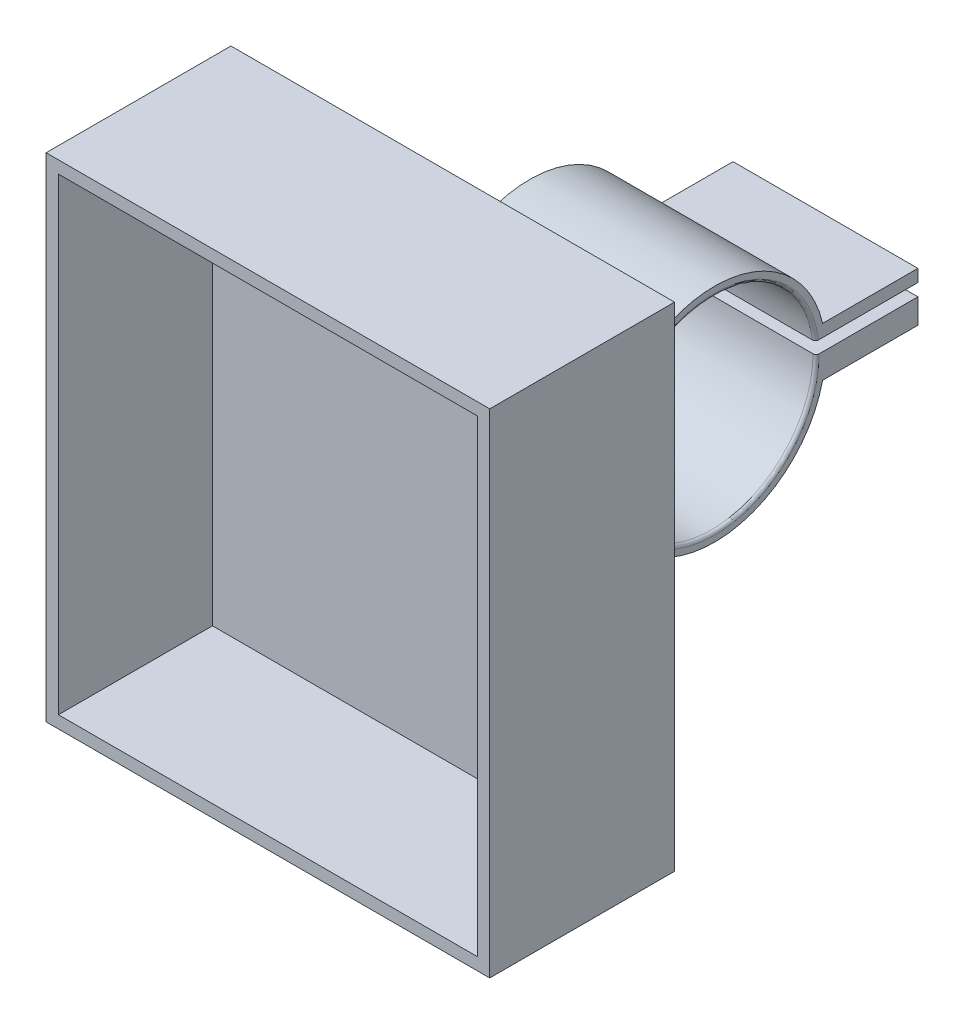
from build123d import *

# Parameters (mm, degrees)
ESBO_O1_W                     = 72
ESBO_O1_H                     = 80
RESSALTO_EXTRUS_O1_DEPTH      = 30
ESBO_O3_W                     = 68
ESBO_O3_H                     = 76
CORTE_EXTRUS_O1_DEPTH         = 25
ESBO_O7_R                     = 10.25
RESSALTO_EXTRUS_O3_DEPTH      = 15
FILETE1_R                     = 4
RESSALTO_EXTRUS_O4_DEPTH      = 15
RESSALTO_EXTRUS_O4_DEPTH_BACK = 15
ESBO_O9_R                     = 18
ESBO_O10_R                    = 16.5
CORTE_EXTRUS_O2_DEPTH         = 40
RESSALTO_EXTRUS_O5_DEPTH      = 15
RESSALTO_EXTRUS_O5_DEPTH_BACK = 15
ESBO_O12_W                    = 17
ESBO_O12_H                    = 2
CORTE_EXTRUS_O3_DEPTH         = 40
FILETE2_R                     = 0.5
FILETE3_R                     = 0.5


with BuildPart() as part:
    # Esboço1 → Ressalto-extrusão1 (new body)
    with BuildSketch(Plane.XY):
        Rectangle(ESBO_O1_W, ESBO_O1_H)
    extrude(amount=RESSALTO_EXTRUS_O1_DEPTH)

    # Esboço3 → Corte-extrusão1 (cut)
    with BuildSketch(Plane.XY.offset(30)):
        Rectangle(ESBO_O3_W, ESBO_O3_H)
    extrude(amount=-CORTE_EXTRUS_O1_DEPTH, mode=Mode.SUBTRACT)

    # Esboço7 → Ressalto-extrusão3 (add)
    with BuildSketch(Plane(origin=(0, 0, 0), x_dir=(-1, 0, 0), z_dir=(0, 0, -1))):
        Circle(ESBO_O7_R)
    extrude(amount=RESSALTO_EXTRUS_O3_DEPTH)

    # Filete1
    filete1_edges = [part.edges().sort_by_distance(p)[0] for p in [
        (10.25, 0, 0),
    ]]
    fillet(filete1_edges, radius=FILETE1_R)

    # Esboço9 → Ressalto-extrusão4 (add, two sides: drawn at the far end of the back side and taken through both)
    with BuildSketch(Plane(origin=(0, 0, 0), x_dir=(0, 0, -1), z_dir=(1, 0, 0)).offset(-RESSALTO_EXTRUS_O4_DEPTH_BACK)):
        with Locations((27.479364999, 0)):
            Circle(ESBO_O9_R)
    extrude(amount=RESSALTO_EXTRUS_O4_DEPTH + RESSALTO_EXTRUS_O4_DEPTH_BACK)

    # Esboço10 → Corte-extrusão2 (cut)
    with BuildSketch(Plane(origin=(15, 0, 0), x_dir=(0, 0, -1), z_dir=(1, 0, 0))):
        with Locations((27.479364999, 0)):
            Circle(ESBO_O10_R)
    extrude(amount=-CORTE_EXTRUS_O2_DEPTH, mode=Mode.SUBTRACT)

    # Esboço11 → Ressalto-extrusão5 (add, two sides: drawn at the far end of the back side and taken through both)
    with BuildSketch(Plane(origin=(0, 0, 0), x_dir=(0, 0, -1), z_dir=(1, 0, 0)).offset(-RESSALTO_EXTRUS_O5_DEPTH_BACK)):
        Polygon((60.492568737, 0), (60.492568737, 4), (45.029293774, 4), (45.029293774, -4), (60.492568737, -4), align=None)
    extrude(amount=RESSALTO_EXTRUS_O5_DEPTH + RESSALTO_EXTRUS_O5_DEPTH_BACK)

    # Esboço12 → Corte-extrusão3 (cut)
    with BuildSketch(Plane(origin=(15, 0, 0), x_dir=(0, 0, -1), z_dir=(1, 0, 0))):
        with Locations((51.992568737, 1)):
            Rectangle(ESBO_O12_W, ESBO_O12_H)
    extrude(amount=-CORTE_EXTRUS_O3_DEPTH, mode=Mode.SUBTRACT)

    # Filete2
    filete2_edges = [part.edges().sort_by_distance(p)[0] for p in [
        (15, -1.001848456, -11.009808245),
    ]]
    fillet(filete2_edges, radius=FILETE2_R)

    # Filete3
    filete3_edges = [part.edges().sort_by_distance(p)[0] for p in [
        (-15, -1.001848456, -11.009808245),
    ]]
    fillet(filete3_edges, radius=FILETE3_R)


solid = part.part
